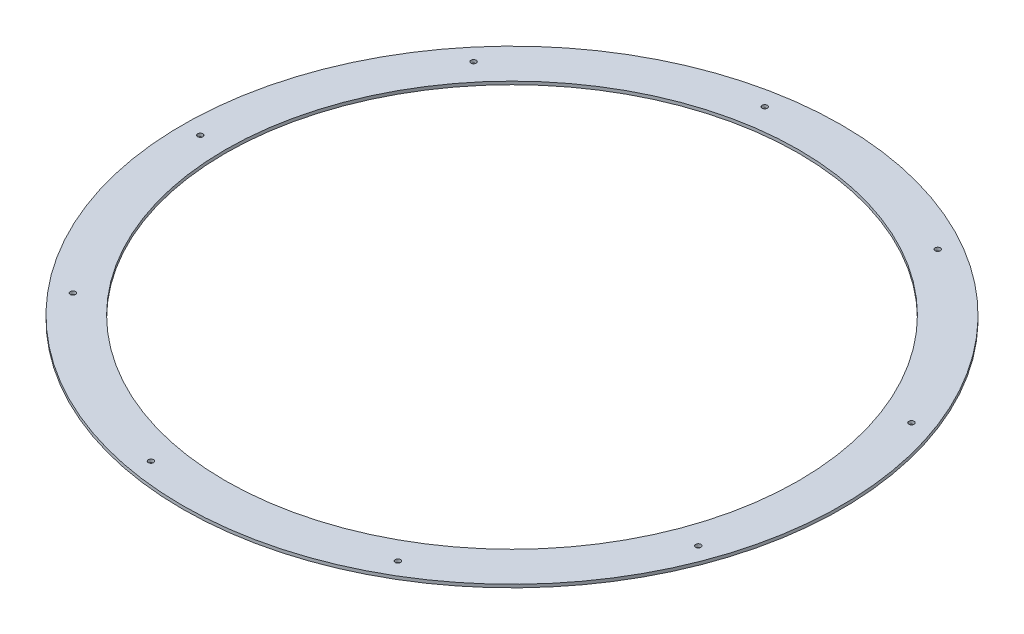
from build123d import *

# Parameters (mm, degrees)
SKETCH1_R           = 318.262
SKETCH1_R_2         = 276.86
BOSS_EXTRUDE1_DEPTH = 2.9972
SKETCH2_R           = 2.5527
CUT_EXTRUDE1_DEPTH  = 451.100416014
CIRPATTERN1_COUNT   = 9


with BuildPart() as part:
    # Sketch1 → Boss-Extrude1 (new body)
    with BuildSketch(Plane(origin=(0, 0, 0), x_dir=(1, 0, 0), z_dir=(0, 1, 0))):
        Circle(SKETCH1_R)
        Circle(SKETCH1_R_2, mode=Mode.SUBTRACT)
    extrude(amount=BOSS_EXTRUDE1_DEPTH)

    # Sketch2 → Cut-Extrude1 (cut, through all)
    with BuildSketch(Plane(origin=(0, 2.9972, 0), x_dir=(1, 0, 0), z_dir=(0, 1, 0))):
        with Locations((-300.99, 0)):
            Circle(SKETCH2_R)
    cut_extrude1 = extrude(amount=-CUT_EXTRUDE1_DEPTH, mode=Mode.SUBTRACT)

    # CirPattern1: Cut-Extrude1 ×9 about axis
    cirpattern1_axis = Axis((0, 3.33375, 0), (0, -1, 0))
    for i in range(1, CIRPATTERN1_COUNT):
        add(cut_extrude1.rotate(cirpattern1_axis, i * 360 / CIRPATTERN1_COUNT), mode=Mode.SUBTRACT)


solid = part.part
